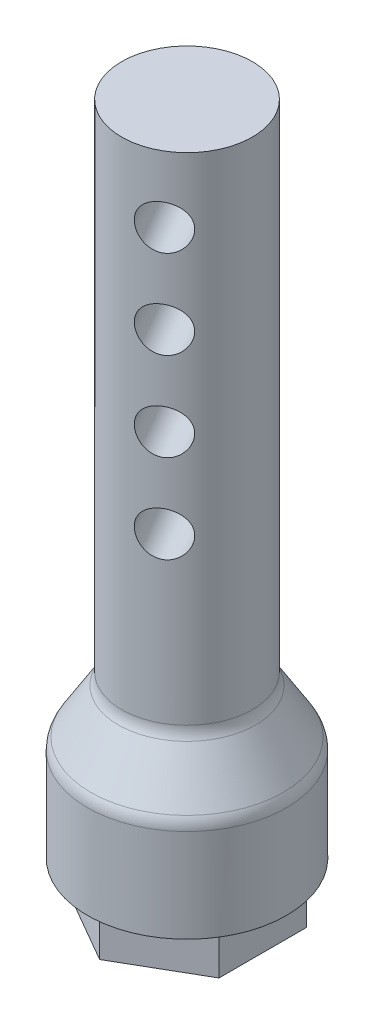
from build123d import *

# Parameters (mm, degrees)
TAGLIO_ESTRUSIONE1_START      = -2
SCHIZZO2_R                    = 4.5
TAGLIO_ESTRUSIONE1_DEPTH      = 2
FORO_FILETTATO_M3X0_5_1_D     = 2.5
FORO_FILETTATO_M3X0_5_1_DEPTH = 9
FORO_FILETTATO_M3X0_5_1_TIP   = 0.751075774
SCHIZZO5_R                    = 1
TAGLIO_ESTRUSIONE2_DEPTH      = 34.021984656


with BuildPart() as part:
    # Schizzo1 → Rivoluzione1 (revolve)
    with BuildSketch(Plane.XY):
        with BuildLine():
            Line((0, 0), (4.5, 0))
            Line((4.5, 0), (4.5, 6.215934246))
            ThreePointArc((4.5, 6.215934246), (4.461941718, 6.489188945), (4.350663738, 6.741644436))
            Line((4.350663738, 6.741644436), (3.104336262, 8.758355564))
            ThreePointArc((3.104336262, 8.758355564), (2.993058282, 9.010811055), (2.955, 9.284065754))
            Line((2.955, 9.284065754), (2.955, 31.7))
            Line((2.955, 31.7), (0, 31.7))
            Line((0, 31.7), (0, 0))
        make_face()
    revolve(axis=Axis((0, 31.7, 0), (0, -1, 0)))

    # Schizzo2 → Taglio-Estrusione1 (cut)
    with BuildSketch(Plane.XZ.offset(TAGLIO_ESTRUSIONE1_START)):
        Circle(SCHIZZO2_R)
        Polygon((0, 3.95), (-3.420800345, 1.975), (-3.420800345, -1.975), (0, -3.95), (3.420800345, -1.975), (3.420800345, 1.975), align=None, mode=Mode.SUBTRACT)
    extrude(amount=TAGLIO_ESTRUSIONE1_DEPTH, mode=Mode.SUBTRACT)

    # Foro filettato M3x0.5-1
    with Locations(Plane(origin=(0, 0, 0), x_dir=(-1, 0, 0), z_dir=(0, -1, 0))):
        with Locations((0, 0)):
            Hole(FORO_FILETTATO_M3X0_5_1_D / 2, depth=FORO_FILETTATO_M3X0_5_1_DEPTH)
            with Locations((0, 0, -(FORO_FILETTATO_M3X0_5_1_DEPTH + FORO_FILETTATO_M3X0_5_1_TIP / 2))):  # 118° drill point
                Cone(0, FORO_FILETTATO_M3X0_5_1_D / 2, FORO_FILETTATO_M3X0_5_1_TIP, mode=Mode.SUBTRACT)

    # Schizzo5 → Taglio-Estrusione2 (cut, through all)
    with BuildSketch(Plane(origin=(-1.4775, 0, -2.559105068), x_dir=(-0.8660254037844385, 0, 0.5000000000000004), z_dir=(-0.5000000000000003, 0, -0.8660254037844384))):
        with Locations((0, 16.7)):
            Circle(SCHIZZO5_R)
        with Locations((0, 20.7)):
            Circle(SCHIZZO5_R)
        with Locations((0, 24.7)):
            Circle(SCHIZZO5_R)
        with Locations((0, 28.7)):
            Circle(SCHIZZO5_R)
    extrude(amount=-TAGLIO_ESTRUSIONE2_DEPTH, mode=Mode.SUBTRACT)


solid = part.part
